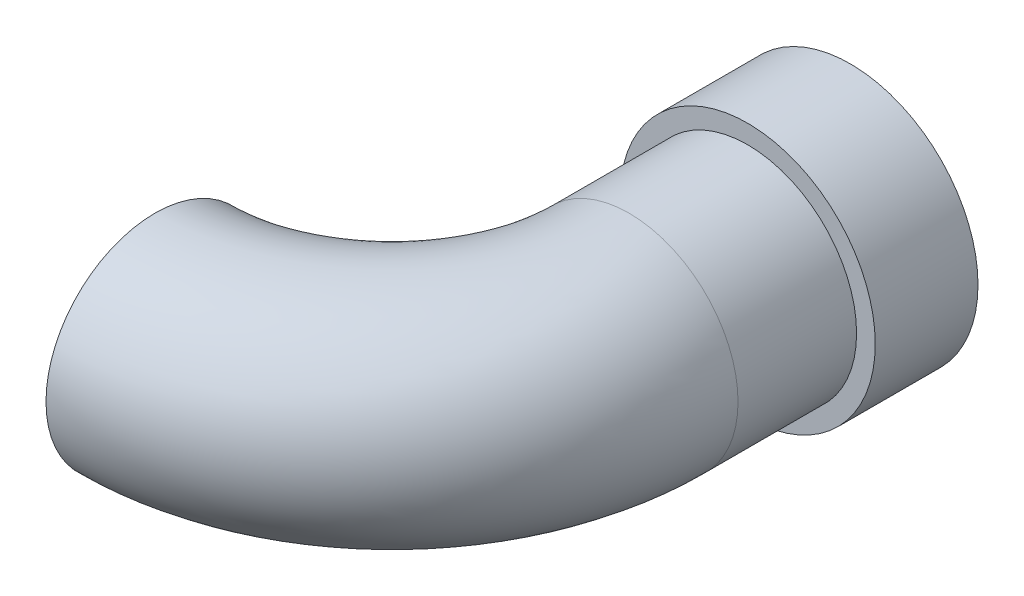
from build123d import *

# Parameters (mm, degrees)
SKETCH1_R           = 20.5
SKETCH1_R_2         = 17.5
BOSS_EXTRUDE1_DEPTH = 16.51
SKETCH4_R           = 17.5
SKETCH4_R_2         = 15.5


with BuildPart() as part:
    # Sketch1 → Boss-Extrude1 (new body)
    with BuildSketch(Plane.XY):
        Circle(SKETCH1_R)
        Circle(SKETCH1_R_2, mode=Mode.SUBTRACT)
    extrude(amount=BOSS_EXTRUDE1_DEPTH)

    # Sweep3: sweep along a path in Sketch5
    with BuildLine(Plane(origin=(0, 0, 0), x_dir=(1, 0, 0), z_dir=(0, 1, 0))) as sweep3_path:
        Line((0, -10.16), (0, -35.56))
        ThreePointArc((0, -35.56), (-11.159231637, -62.500768363), (-38.1, -73.66))
    # Sketch4 → Sweep3 (sweep)
    with BuildSketch(Plane.XY.offset(10.16)):
        Circle(SKETCH4_R)
        Circle(SKETCH4_R_2, mode=Mode.SUBTRACT)
    sweep(path=sweep3_path.line)


solid = part.part
